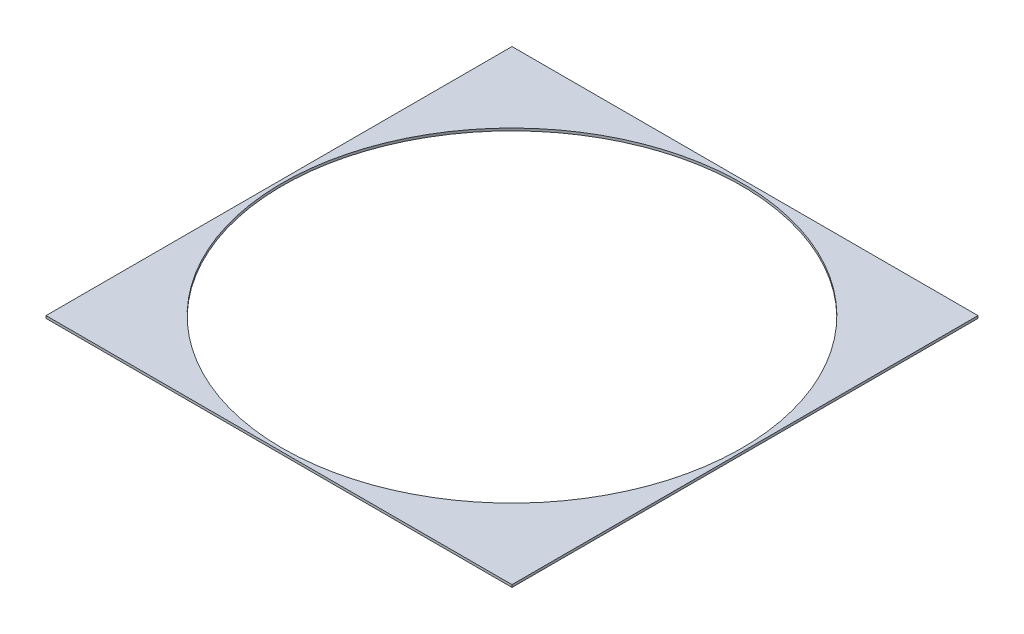
from build123d import *

# Parameters (mm, degrees)
SKETCH1_W           = 284
SKETCH1_H           = 284
SKETCH1_R           = 140
BOSS_EXTRUDE1_DEPTH = 1.5


with BuildPart() as part:
    # Sketch1 → Boss-Extrude1 (new body)
    with BuildSketch(Plane(origin=(0, 0, 0), x_dir=(1, 0, 0), z_dir=(0, 1, 0))):
        Rectangle(SKETCH1_W, SKETCH1_H)
        with Locations(Location((0, 0, 0), (0, 0, 270))):
            Circle(SKETCH1_R, mode=Mode.SUBTRACT)
    extrude(amount=BOSS_EXTRUDE1_DEPTH)


solid = part.part
